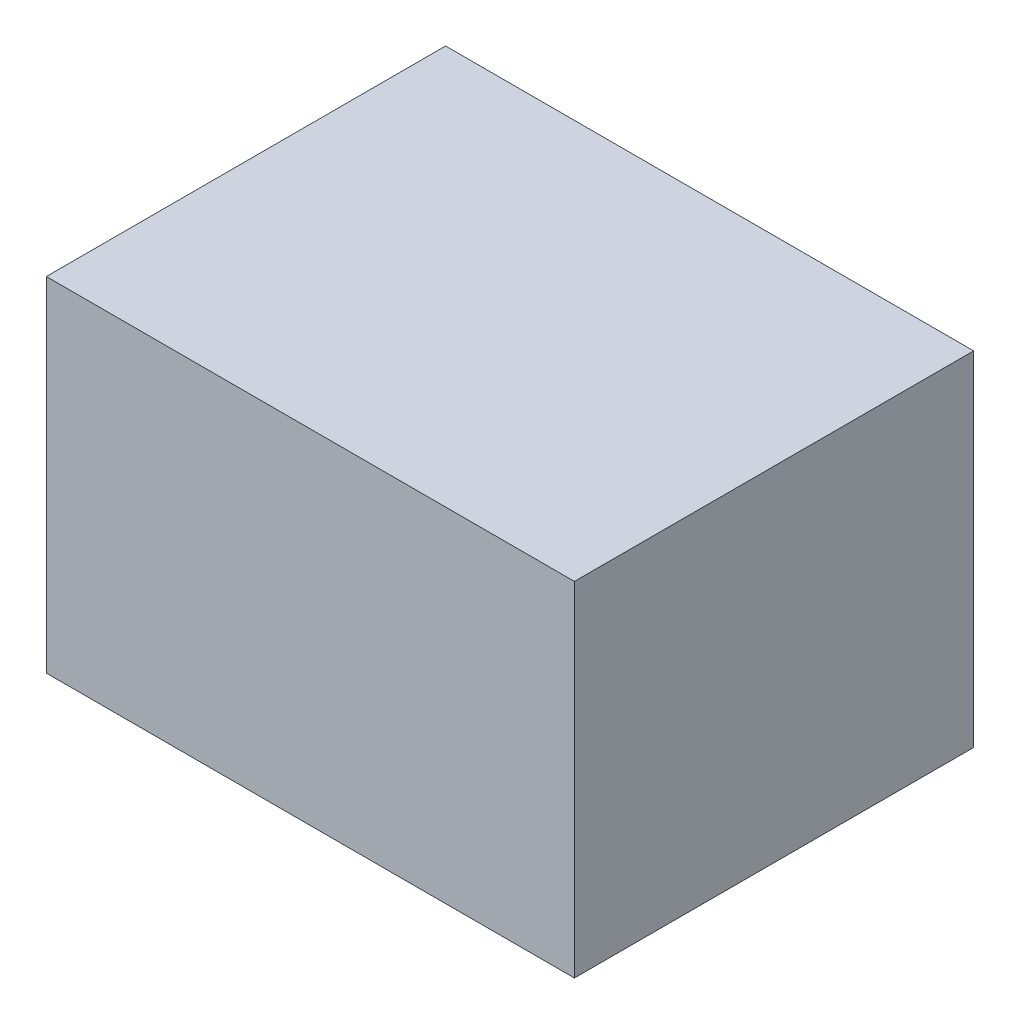
from build123d import *

# Parameters (mm, degrees)
SKETCH2_W           = 1562.1
SKETCH2_H           = 1016
BOSS_EXTRUDE1_DEPTH = 1181.1


with BuildPart() as part:
    # Sketch2 → Boss-Extrude1 (new body)
    with BuildSketch(Plane.XY):
        with Locations((767.019852555, 499.92203632)):
            Rectangle(SKETCH2_W, SKETCH2_H)
    extrude(amount=BOSS_EXTRUDE1_DEPTH)


solid = part.part
